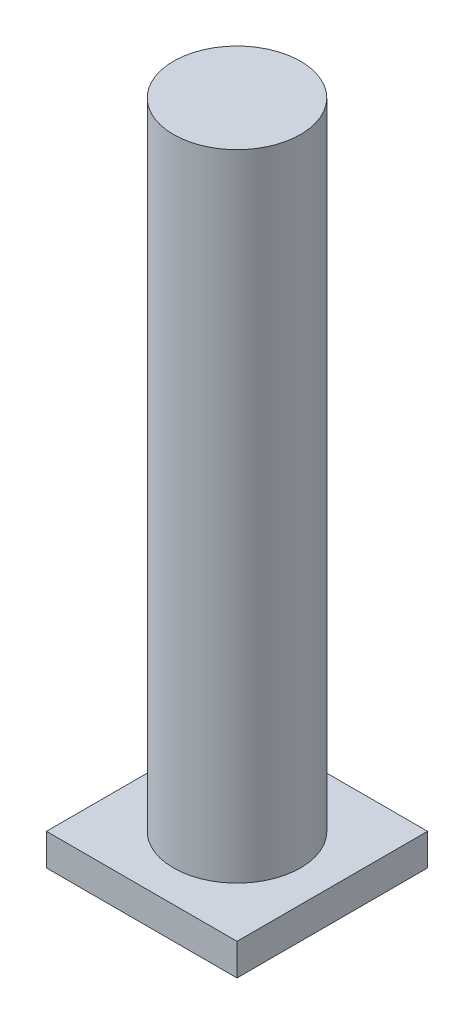
from build123d import *

# Parameters (mm, degrees)
SKETCH1_W           = 30
SKETCH1_H           = 30
BOSS_EXTRUDE1_DEPTH = 5
SKETCH2_R           = 10
BOSS_EXTRUDE2_DEPTH = 100


with BuildPart() as part:
    # Sketch1 → Boss-Extrude1 (new body)
    with BuildSketch(Plane(origin=(0, 0, 0), x_dir=(1, 0, 0), z_dir=(0, 1, 0))):
        Rectangle(SKETCH1_W, SKETCH1_H)
    extrude(amount=BOSS_EXTRUDE1_DEPTH)

    # Sketch2 → Boss-Extrude2 (add)
    with BuildSketch(Plane(origin=(0, 5, 0), x_dir=(1, 0, 0), z_dir=(0, 1, 0))):
        with Locations(Location((0, 0, 0), (0, 0, 270))):
            Circle(SKETCH2_R)
    extrude(amount=BOSS_EXTRUDE2_DEPTH)


solid = part.part
